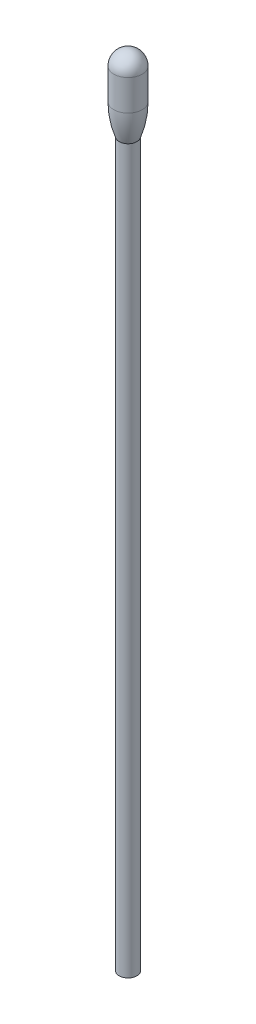
from build123d import *


with BuildPart() as part:
    # Esquisse1 → Révolution3 (revolve)
    with BuildSketch(Plane.XY, mode=Mode.PRIVATE) as r_volution3_sk:
        with BuildLine():
            Line((-0.625, 0), (-0.625, 132.922166212))
            Line((-0.625, 132.922166212), (0, 132.922166212))
            Line((0, 132.922166212), (0, 135))
            ThreePointArc((0, 135), (-1.698212195, 134.296577477), (-2.401634718, 132.598365282))
            Line((-2.401634718, 132.598365282), (-2.401634718, 127.386887788))
            ThreePointArc((-2.401634718, 127.386887788), (-2.174513205, 124.78141827), (-1.5, 122.254545197))
            Line((-1.5, 122.254545197), (-1.5, 0))
            Line((-1.5, 0), (-0.625, 0))
        make_face()
    revolve(r_volution3_sk.sketch.rotate(Axis((0, -0.0531705, 0), (0, 1, 0)), 270), axis=Axis((0, -0.0531705, 0), (0, 1, 0)))


solid = part.part
